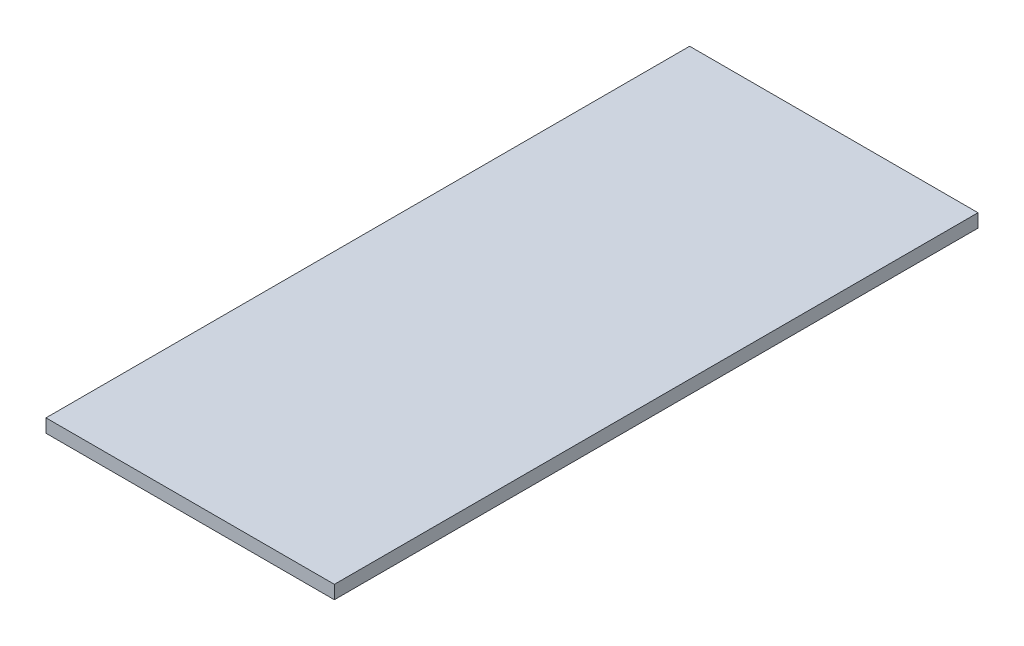
from build123d import *

# Parameters (mm, degrees)
SKETCH1_W           = 172.4
SKETCH1_H           = 384.8
BOSS_EXTRUDE1_DEPTH = 4


with BuildPart() as part:
    # Sketch1 → Boss-Extrude1 (new, symmetric)
    with BuildSketch(Plane(origin=(0, 0, 0), x_dir=(1, 0, 0), z_dir=(0, 1, 0))):
        Rectangle(SKETCH1_W, SKETCH1_H)
    extrude(amount=BOSS_EXTRUDE1_DEPTH, both=True)


solid = part.part
